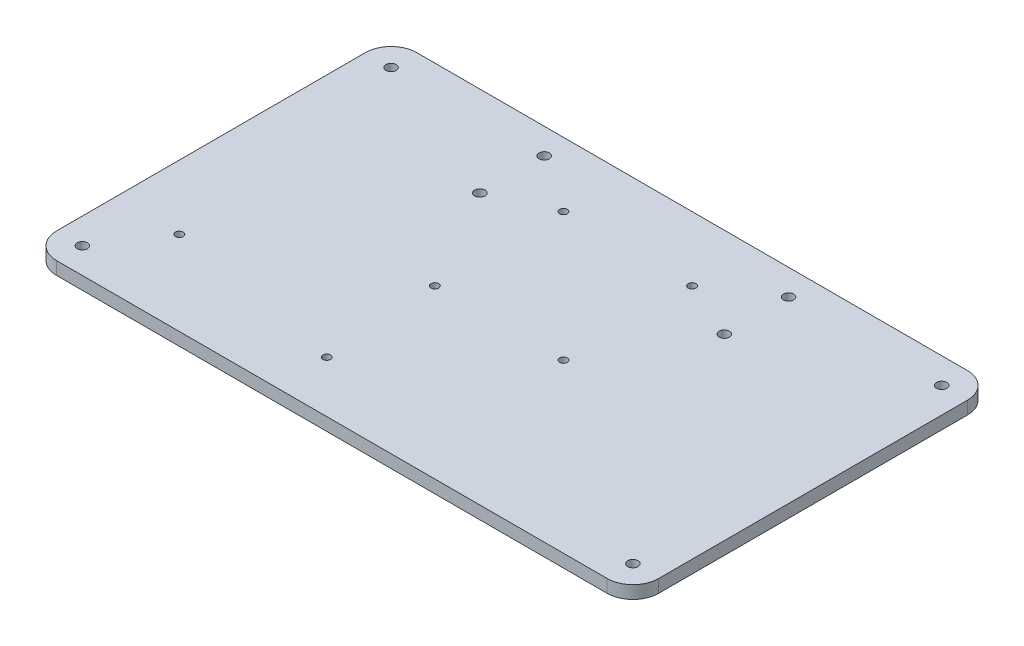
from build123d import *

# Parameters (mm, degrees)
SKETCH_1_W          = 234
SKETCH_1_H          = 140
EXTRUDE_1_DEPTH     = 5
SKETCH_2_R          = 2
CUT_EXTRUDE_1_DEPTH = 5
FILLET_1_R          = 10
SKETCH_3_R          = 2
CUT_EXTRUDE_2_DEPTH = 20
SKETCH_4_R          = 1.5
CUT_EXTRUDE_3_DEPTH = 10
SKETCH_5_R          = 1.5
CUT_EXTRUDE_4_DEPTH = 10


with BuildPart() as part:
    # 草图1 → 凸台-拉伸1 (new body)
    with BuildSketch(Plane(origin=(0, 0, 0), x_dir=(1, 0, 0), z_dir=(0, 1, 0))):
        Rectangle(SKETCH_1_W, SKETCH_1_H)
    extrude(amount=EXTRUDE_1_DEPTH)

    # 草图2 → 切除-拉伸1 (cut)
    with BuildSketch(Plane(origin=(0, 5, 0), x_dir=(1, 0, 0), z_dir=(0, 1, 0))):
        with Locations(Location((-107, 60, 0), (0, 0, 270))):
            Circle(SKETCH_2_R)
        with Locations(Location((107, 60, 0), (0, 0, 270))):
            Circle(SKETCH_2_R)
        with Locations(Location((107, -60, 0), (0, 0, 270))):
            Circle(SKETCH_2_R)
        with Locations(Location((-107, -60, 0), (0, 0, 270))):
            Circle(SKETCH_2_R)
    extrude(amount=-CUT_EXTRUDE_1_DEPTH, mode=Mode.SUBTRACT)

    # 圆角1
    fillet_1_edges = [part.edges().sort_by_distance(p)[0] for p in [
        (-117, 2.5, -70),
        (117, 2.5, -70),
        (117, 2.5, 70),
        (-117, 2.5, 70),
    ]]
    fillet(fillet_1_edges, radius=FILLET_1_R)

    # 草图3 → 切除-拉伸2 (cut)
    with BuildSketch(Plane(origin=(0, 5, 0), x_dir=(1, 0, 0), z_dir=(0, 1, 0))):
        with Locations(Location((-47.5, 60, 0), (0, 0, 270))):
            Circle(SKETCH_3_R)
        with Locations(Location((47.5, 60, 0), (0, 0, 270))):
            Circle(SKETCH_3_R)
        with Locations(Location((47.5, 35, 0), (0, 0, 270))):
            Circle(SKETCH_3_R)
        with Locations(Location((-47.5, 35, 0), (0, 0, 270))):
            Circle(SKETCH_3_R)
    extrude(amount=-CUT_EXTRUDE_2_DEPTH, mode=Mode.SUBTRACT)

    # 草图4 → 切除-拉伸3 (cut)
    with BuildSketch(Plane(origin=(0, 5, 0), x_dir=(1, 0, 0), z_dir=(0, 1, 0))):
        with Locations(Location((-25, 45, 0), (0, 0, 270))):
            Circle(SKETCH_4_R)
        with Locations(Location((25, 45, 0), (0, 0, 270))):
            Circle(SKETCH_4_R)
        with Locations(Location((25, -5, 0), (0, 0, 270))):
            Circle(SKETCH_4_R)
        with Locations(Location((-25, -5, 0), (0, 0, 270))):
            Circle(SKETCH_4_R)
    extrude(amount=-CUT_EXTRUDE_3_DEPTH, mode=Mode.SUBTRACT)

    # 草图5 → 切除-拉伸4 (cut)
    with BuildSketch(Plane(origin=(0, 5, 0), x_dir=(1, 0, 0), z_dir=(0, 1, 0))):
        with Locations(Location((-92, -37.3, 0), (0, 0, 270))):
            Circle(SKETCH_5_R)
        with Locations(Location((-22, -50, 0), (0, 0, 270))):
            Circle(SKETCH_5_R)
    extrude(amount=-CUT_EXTRUDE_4_DEPTH, mode=Mode.SUBTRACT)


solid = part.part
